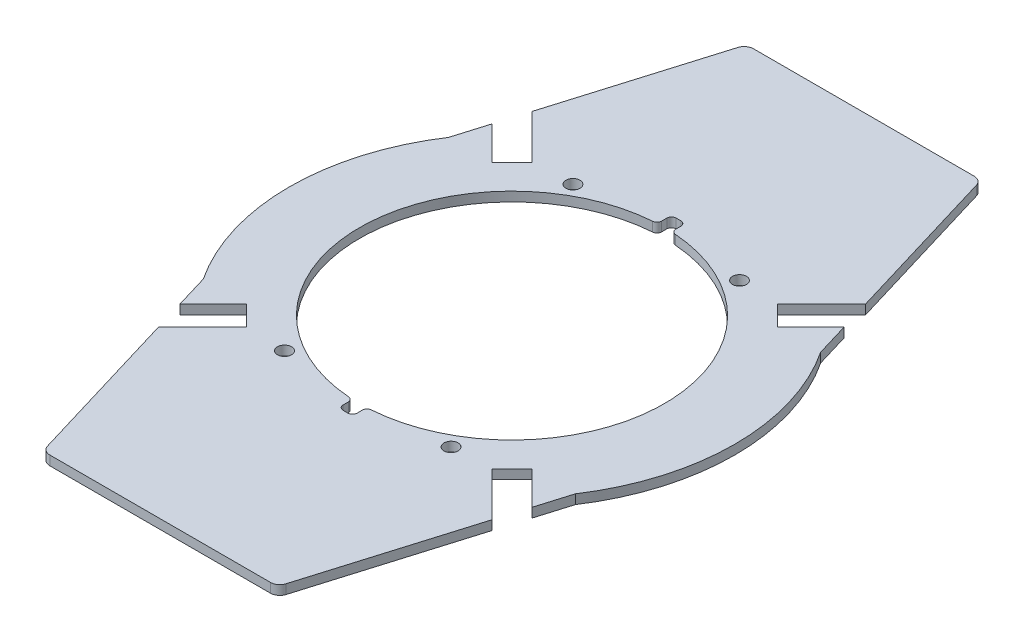
from build123d import *

# Parameters (mm, degrees)
SKETCH1_R           = 32.5
BOSS_EXTRUDE1_DEPTH = 2
CUT_EXTRUDE1_DEPTH  = 2
SKETCH3_W           = 3
SKETCH3_H           = 6
CUT_EXTRUDE2_DEPTH  = 2
FILLET1_R           = 1
FILLET2_R           = 2
SKETCH4_R           = 1.5
CUT_EXTRUDE3_DEPTH  = 2


with BuildPart() as part:
    # Sketch1 → Boss-Extrude1 (new body)
    with BuildSketch(Plane(origin=(0, 0, 0), x_dir=(1, 0, 0), z_dir=(0, 1, 0))):
        with BuildLine():
            Line((-39.655963303, 26.146788991), (-25, 75))
            Line((-25, 75), (25, 75))
            Line((25, 75), (39.655963303, 26.146788991))
            ThreePointArc((39.655963303, 26.146788991), (47.5, 0), (39.655963303, -26.146788991))
            Line((39.655963303, -26.146788991), (25, -75))
            Line((25, -75), (-25, -75))
            Line((-25, -75), (-39.655963303, -26.146788991))
            ThreePointArc((-39.655963303, -26.146788991), (-47.5, 0), (-39.655963303, 26.146788991))
        make_face()
        with Locations(Location((0, 0, 0), (0, 0, 270))):
            Circle(SKETCH1_R, mode=Mode.SUBTRACT)
    extrude(amount=BOSS_EXTRUDE1_DEPTH)

    # Sketch2 → Cut-Extrude1 (cut)
    with BuildSketch(Plane(origin=(0, 2, 0), x_dir=(1, 0, 0), z_dir=(0, 1, 0))):
        Polygon((41.012193309, 36.769552622), (30.405591591, 26.162950904), (26.162950904, 30.405591591), (36.769552622, 41.012193309), align=None)
        Polygon((-41.012193309, 36.769552622), (-36.769552622, 41.012193309), (-26.162950904, 30.405591591), (-30.405591591, 26.162950904), align=None)
        Polygon((36.769552622, -41.012193309), (26.162950904, -30.405591591), (30.405591591, -26.162950904), (41.012193309, -36.769552622), align=None)
        Polygon((-41.012193309, -36.769552622), (-30.405591591, -26.162950904), (-26.162950904, -30.405591591), (-36.769552622, -41.012193309), align=None)
    extrude(amount=-CUT_EXTRUDE1_DEPTH, mode=Mode.SUBTRACT)

    # Sketch3 → Cut-Extrude2 (cut)
    with BuildSketch(Plane(origin=(0, 2, 0), x_dir=(1, 0, 0), z_dir=(0, 1, 0))):
        with Locations((0, 32.5)):
            Rectangle(SKETCH3_W, SKETCH3_H)
        with Locations((0, -32.5)):
            Rectangle(SKETCH3_W, SKETCH3_H)
    extrude(amount=-CUT_EXTRUDE2_DEPTH, mode=Mode.SUBTRACT)

    # Fillet1
    fillet1_edges = [part.edges().sort_by_distance(p)[0] for p in [
        (-1.5, 1, -32.465366161),
        (1.5, 1, -32.465366161),
        (1.5, 1, -35.5),
        (-1.5, 1, -35.5),
        (1.5, 1, 32.465366161),
        (-1.5, 1, 32.465366161),
        (-1.5, 1, 35.5),
        (1.5, 1, 35.5),
    ]]
    fillet(fillet1_edges, radius=FILLET1_R)

    # Fillet2
    fillet2_edges = [part.edges().sort_by_distance(p)[0] for p in [
        (25, 1, 75),
        (-25, 1, 75),
        (-25, 1, -75),
        (25, 1, -75),
    ]]
    fillet(fillet2_edges, radius=FILLET2_R)

    # Sketch4 → Cut-Extrude3 (cut)
    with BuildSketch(Plane(origin=(0, 2, 0), x_dir=(1, 0, 0), z_dir=(0, 1, 0))):
        with Locations(Location((-17.75, 30.743901834, 0), (0, 0, 270))):
            Circle(SKETCH4_R)
        with Locations(Location((17.75, 30.743901834, 0), (0, 0, 90))):
            Circle(SKETCH4_R)
        with Locations(Location((17.75, -30.743901834, 0), (0, 0, 270))):
            Circle(SKETCH4_R)
        with Locations(Location((-17.75, -30.743901834, 0), (0, 0, 90))):
            Circle(SKETCH4_R)
    extrude(amount=-CUT_EXTRUDE3_DEPTH, mode=Mode.SUBTRACT)


solid = part.part
